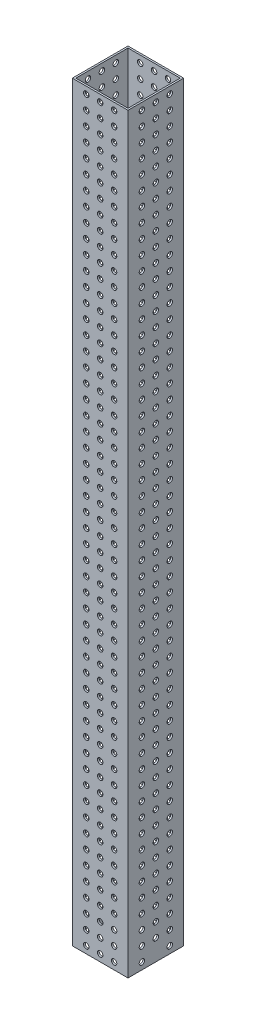
from build123d import *

# Parameters (mm, degrees)
SKETCH1_W           = 50.8
SKETCH1_H           = 50.8
SKETCH1_W_2         = 47.625
SKETCH1_H_2         = 47.625
BOSS_EXTRUDE1_DEPTH = 685.8
SKETCH2_R           = 2.4892
CUT_EXTRUDE1_DEPTH  = 689.147832955
SKETCH4_R           = 2.4892
CUT_EXTRUDE2_DEPTH  = 689.147832955


with BuildPart() as part:
    # Sketch1 → Boss-Extrude1 (new body)
    with BuildSketch(Plane(origin=(0, 0, 0), x_dir=(1, 0, 0), z_dir=(0, 1, 0))):
        Rectangle(SKETCH1_W, SKETCH1_H)
        Rectangle(SKETCH1_W_2, SKETCH1_H_2, mode=Mode.SUBTRACT)
    extrude(amount=BOSS_EXTRUDE1_DEPTH)

    # Sketch2 → Cut-Extrude1 (cut, through all)
    with BuildSketch(Plane.XY.offset(25.4)):
        with Locations((-12.7, 679.45)):
            Circle(SKETCH2_R)
        with Locations((-12.7, 666.75)):
            Circle(SKETCH2_R)
        with Locations((-12.7, 654.05)):
            Circle(SKETCH2_R)
        with Locations((-12.7, 641.35)):
            Circle(SKETCH2_R)
        with Locations((-12.7, 628.65)):
            Circle(SKETCH2_R)
        with Locations((-12.7, 615.95)):
            Circle(SKETCH2_R)
        with Locations((-12.7, 603.25)):
            Circle(SKETCH2_R)
        with Locations((-12.7, 590.55)):
            Circle(SKETCH2_R)
        with Locations((-12.7, 577.85)):
            Circle(SKETCH2_R)
        with Locations((-12.7, 565.15)):
            Circle(SKETCH2_R)
        with Locations((-12.7, 552.45)):
            Circle(SKETCH2_R)
        with Locations((-12.7, 539.75)):
            Circle(SKETCH2_R)
        with Locations((-12.7, 527.05)):
            Circle(SKETCH2_R)
        with Locations((-12.7, 514.35)):
            Circle(SKETCH2_R)
        with Locations((-12.7, 501.65)):
            Circle(SKETCH2_R)
        with Locations((-12.7, 488.95)):
            Circle(SKETCH2_R)
        with Locations((-12.7, 476.25)):
            Circle(SKETCH2_R)
        with Locations((-12.7, 463.55)):
            Circle(SKETCH2_R)
        with Locations((-12.7, 450.85)):
            Circle(SKETCH2_R)
        with Locations((-12.7, 438.15)):
            Circle(SKETCH2_R)
        with Locations((-12.7, 425.45)):
            Circle(SKETCH2_R)
        with Locations((-12.7, 412.75)):
            Circle(SKETCH2_R)
        with Locations((-12.7, 400.05)):
            Circle(SKETCH2_R)
        with Locations((-12.7, 387.35)):
            Circle(SKETCH2_R)
        with Locations((-12.7, 374.65)):
            Circle(SKETCH2_R)
        with Locations((-12.7, 361.95)):
            Circle(SKETCH2_R)
        with Locations((-12.7, 349.25)):
            Circle(SKETCH2_R)
        with Locations((-12.7, 336.55)):
            Circle(SKETCH2_R)
        with Locations((-12.7, 323.85)):
            Circle(SKETCH2_R)
        with Locations((-12.7, 311.15)):
            Circle(SKETCH2_R)
        with Locations((-12.7, 298.45)):
            Circle(SKETCH2_R)
        with Locations((-12.7, 285.75)):
            Circle(SKETCH2_R)
        with Locations((-12.7, 273.05)):
            Circle(SKETCH2_R)
        with Locations((-12.7, 260.35)):
            Circle(SKETCH2_R)
        with Locations((-12.7, 247.65)):
            Circle(SKETCH2_R)
        with Locations((-12.7, 234.95)):
            Circle(SKETCH2_R)
        with Locations((-12.7, 222.25)):
            Circle(SKETCH2_R)
        with Locations((-12.7, 209.55)):
            Circle(SKETCH2_R)
        with Locations((-12.7, 196.85)):
            Circle(SKETCH2_R)
        with Locations((-12.7, 184.15)):
            Circle(SKETCH2_R)
        with Locations((-12.7, 171.45)):
            Circle(SKETCH2_R)
        with Locations((-12.7, 158.75)):
            Circle(SKETCH2_R)
        with Locations((-12.7, 146.05)):
            Circle(SKETCH2_R)
        with Locations((-12.7, 133.35)):
            Circle(SKETCH2_R)
        with Locations((-12.7, 120.65)):
            Circle(SKETCH2_R)
        with Locations((-12.7, 107.95)):
            Circle(SKETCH2_R)
        with Locations((-12.7, 95.25)):
            Circle(SKETCH2_R)
        with Locations((-12.7, 82.55)):
            Circle(SKETCH2_R)
        with Locations((-12.7, 69.85)):
            Circle(SKETCH2_R)
        with Locations((-12.7, 57.15)):
            Circle(SKETCH2_R)
        with Locations((-12.7, 44.45)):
            Circle(SKETCH2_R)
        with Locations((-12.7, 31.75)):
            Circle(SKETCH2_R)
        with Locations((-12.7, 19.05)):
            Circle(SKETCH2_R)
        with Locations((-12.7, 6.35)):
            Circle(SKETCH2_R)
        with Locations((12.7, 6.35)):
            Circle(SKETCH2_R)
        with Locations((12.7, 19.05)):
            Circle(SKETCH2_R)
        with Locations((12.7, 31.75)):
            Circle(SKETCH2_R)
        with Locations((12.7, 44.45)):
            Circle(SKETCH2_R)
        with Locations((12.7, 57.15)):
            Circle(SKETCH2_R)
        with Locations((12.7, 69.85)):
            Circle(SKETCH2_R)
        with Locations((12.7, 82.55)):
            Circle(SKETCH2_R)
        with Locations((12.7, 95.25)):
            Circle(SKETCH2_R)
        with Locations((12.7, 107.95)):
            Circle(SKETCH2_R)
        with Locations((12.7, 120.65)):
            Circle(SKETCH2_R)
        with Locations((12.7, 133.35)):
            Circle(SKETCH2_R)
        with Locations((12.7, 146.05)):
            Circle(SKETCH2_R)
        with Locations((12.7, 158.75)):
            Circle(SKETCH2_R)
        with Locations((12.7, 171.45)):
            Circle(SKETCH2_R)
        with Locations((12.7, 184.15)):
            Circle(SKETCH2_R)
        with Locations((12.7, 196.85)):
            Circle(SKETCH2_R)
        with Locations((12.7, 209.55)):
            Circle(SKETCH2_R)
        with Locations((12.7, 222.25)):
            Circle(SKETCH2_R)
        with Locations((12.7, 234.95)):
            Circle(SKETCH2_R)
        with Locations((12.7, 247.65)):
            Circle(SKETCH2_R)
        with Locations((12.7, 260.35)):
            Circle(SKETCH2_R)
        with Locations((12.7, 273.05)):
            Circle(SKETCH2_R)
        with Locations((12.7, 285.75)):
            Circle(SKETCH2_R)
        with Locations((12.7, 298.45)):
            Circle(SKETCH2_R)
        with Locations((12.7, 311.15)):
            Circle(SKETCH2_R)
        with Locations((12.7, 323.85)):
            Circle(SKETCH2_R)
        with Locations((12.7, 336.55)):
            Circle(SKETCH2_R)
        with Locations((12.7, 374.65)):
            Circle(SKETCH2_R)
        with Locations((12.7, 361.95)):
            Circle(SKETCH2_R)
        with Locations((12.7, 349.25)):
            Circle(SKETCH2_R)
        with Locations((12.7, 387.35)):
            Circle(SKETCH2_R)
        with Locations((12.7, 400.05)):
            Circle(SKETCH2_R)
        with Locations((12.7, 412.75)):
            Circle(SKETCH2_R)
        with Locations((12.7, 425.45)):
            Circle(SKETCH2_R)
        with Locations((12.7, 438.15)):
            Circle(SKETCH2_R)
        with Locations((12.7, 450.85)):
            Circle(SKETCH2_R)
        with Locations((12.7, 463.55)):
            Circle(SKETCH2_R)
        with Locations((12.7, 476.25)):
            Circle(SKETCH2_R)
        with Locations((12.7, 488.95)):
            Circle(SKETCH2_R)
        with Locations((12.7, 501.65)):
            Circle(SKETCH2_R)
        with Locations((12.7, 514.35)):
            Circle(SKETCH2_R)
        with Locations((12.7, 527.05)):
            Circle(SKETCH2_R)
        with Locations((12.7, 539.75)):
            Circle(SKETCH2_R)
        with Locations((12.7, 552.45)):
            Circle(SKETCH2_R)
        with Locations((12.7, 565.15)):
            Circle(SKETCH2_R)
        with Locations((12.7, 577.85)):
            Circle(SKETCH2_R)
        with Locations((12.7, 590.55)):
            Circle(SKETCH2_R)
        with Locations((12.7, 603.25)):
            Circle(SKETCH2_R)
        with Locations((12.7, 615.95)):
            Circle(SKETCH2_R)
        with Locations((12.7, 628.65)):
            Circle(SKETCH2_R)
        with Locations((12.7, 641.35)):
            Circle(SKETCH2_R)
        with Locations((12.7, 654.05)):
            Circle(SKETCH2_R)
        with Locations((12.7, 666.75)):
            Circle(SKETCH2_R)
        with Locations((12.7, 679.45)):
            Circle(SKETCH2_R)
        with Locations((0, 6.35)):
            Circle(SKETCH2_R)
        with Locations((0, 19.05)):
            Circle(SKETCH2_R)
        with Locations((0, 31.75)):
            Circle(SKETCH2_R)
        with Locations((0, 44.45)):
            Circle(SKETCH2_R)
        with Locations((0, 57.15)):
            Circle(SKETCH2_R)
        with Locations((0, 69.85)):
            Circle(SKETCH2_R)
        with Locations((0, 82.55)):
            Circle(SKETCH2_R)
        with Locations((0, 95.25)):
            Circle(SKETCH2_R)
        with Locations((0, 107.95)):
            Circle(SKETCH2_R)
        with Locations((0, 120.65)):
            Circle(SKETCH2_R)
        with Locations((0, 133.35)):
            Circle(SKETCH2_R)
        with Locations((0, 146.05)):
            Circle(SKETCH2_R)
        with Locations((0, 158.75)):
            Circle(SKETCH2_R)
        with Locations((0, 171.45)):
            Circle(SKETCH2_R)
        with Locations((0, 184.15)):
            Circle(SKETCH2_R)
        with Locations((0, 196.85)):
            Circle(SKETCH2_R)
        with Locations((0, 209.55)):
            Circle(SKETCH2_R)
        with Locations((0, 222.25)):
            Circle(SKETCH2_R)
        with Locations((0, 234.95)):
            Circle(SKETCH2_R)
        with Locations((0, 247.65)):
            Circle(SKETCH2_R)
        with Locations((0, 260.35)):
            Circle(SKETCH2_R)
        with Locations((0, 273.05)):
            Circle(SKETCH2_R)
        with Locations((0, 285.75)):
            Circle(SKETCH2_R)
        with Locations((0, 298.45)):
            Circle(SKETCH2_R)
        with Locations((0, 311.15)):
            Circle(SKETCH2_R)
        with Locations((0, 323.85)):
            Circle(SKETCH2_R)
        with Locations((0, 336.55)):
            Circle(SKETCH2_R)
        with Locations((0, 349.25)):
            Circle(SKETCH2_R)
        with Locations((0, 361.95)):
            Circle(SKETCH2_R)
        with Locations((0, 374.65)):
            Circle(SKETCH2_R)
        with Locations((0, 387.35)):
            Circle(SKETCH2_R)
        with Locations((0, 400.05)):
            Circle(SKETCH2_R)
        with Locations((0, 412.75)):
            Circle(SKETCH2_R)
        with Locations((0, 425.45)):
            Circle(SKETCH2_R)
        with Locations((0, 438.15)):
            Circle(SKETCH2_R)
        with Locations((0, 450.85)):
            Circle(SKETCH2_R)
        with Locations((0, 463.55)):
            Circle(SKETCH2_R)
        with Locations((0, 476.25)):
            Circle(SKETCH2_R)
        with Locations((0, 488.95)):
            Circle(SKETCH2_R)
        with Locations((0, 501.65)):
            Circle(SKETCH2_R)
        with Locations((0, 514.35)):
            Circle(SKETCH2_R)
        with Locations((0, 527.05)):
            Circle(SKETCH2_R)
        with Locations((0, 539.75)):
            Circle(SKETCH2_R)
        with Locations((0, 552.45)):
            Circle(SKETCH2_R)
        with Locations((0, 565.15)):
            Circle(SKETCH2_R)
        with Locations((0, 577.85)):
            Circle(SKETCH2_R)
        with Locations((0, 590.55)):
            Circle(SKETCH2_R)
        with Locations((0, 603.25)):
            Circle(SKETCH2_R)
        with Locations((0, 615.95)):
            Circle(SKETCH2_R)
        with Locations((0, 628.65)):
            Circle(SKETCH2_R)
        with Locations((0, 641.35)):
            Circle(SKETCH2_R)
        with Locations((0, 654.05)):
            Circle(SKETCH2_R)
        with Locations((0, 666.75)):
            Circle(SKETCH2_R)
        with Locations((0, 679.45)):
            Circle(SKETCH2_R)
    extrude(amount=-CUT_EXTRUDE1_DEPTH, mode=Mode.SUBTRACT)

    # Sketch4 → Cut-Extrude2 (cut, through all)
    with BuildSketch(Plane(origin=(25.4, 0, 0), x_dir=(0, 0, -1), z_dir=(1, 0, 0))):
        with Locations((-12.7, 679.45)):
            Circle(SKETCH4_R)
        with Locations((-12.7, 666.75)):
            Circle(SKETCH4_R)
        with Locations((-12.7, 654.05)):
            Circle(SKETCH4_R)
        with Locations((-12.7, 641.35)):
            Circle(SKETCH4_R)
        with Locations((-12.7, 628.65)):
            Circle(SKETCH4_R)
        with Locations((-12.7, 615.95)):
            Circle(SKETCH4_R)
        with Locations((-12.7, 603.25)):
            Circle(SKETCH4_R)
        with Locations((-12.7, 590.55)):
            Circle(SKETCH4_R)
        with Locations((-12.7, 577.85)):
            Circle(SKETCH4_R)
        with Locations((-12.7, 565.15)):
            Circle(SKETCH4_R)
        with Locations((-12.7, 552.45)):
            Circle(SKETCH4_R)
        with Locations((-12.7, 539.75)):
            Circle(SKETCH4_R)
        with Locations((-12.7, 527.05)):
            Circle(SKETCH4_R)
        with Locations((-12.7, 514.35)):
            Circle(SKETCH4_R)
        with Locations((-12.7, 501.65)):
            Circle(SKETCH4_R)
        with Locations((-12.7, 488.95)):
            Circle(SKETCH4_R)
        with Locations((-12.7, 476.25)):
            Circle(SKETCH4_R)
        with Locations((-12.7, 463.55)):
            Circle(SKETCH4_R)
        with Locations((-12.7, 450.85)):
            Circle(SKETCH4_R)
        with Locations((-12.7, 438.15)):
            Circle(SKETCH4_R)
        with Locations((-12.7, 425.45)):
            Circle(SKETCH4_R)
        with Locations((-12.7, 412.75)):
            Circle(SKETCH4_R)
        with Locations((-12.7, 400.05)):
            Circle(SKETCH4_R)
        with Locations((-12.7, 387.35)):
            Circle(SKETCH4_R)
        with Locations((-12.7, 374.65)):
            Circle(SKETCH4_R)
        with Locations((-12.7, 361.95)):
            Circle(SKETCH4_R)
        with Locations((-12.7, 349.25)):
            Circle(SKETCH4_R)
        with Locations((-12.7, 336.55)):
            Circle(SKETCH4_R)
        with Locations((-12.7, 323.85)):
            Circle(SKETCH4_R)
        with Locations((-12.7, 311.15)):
            Circle(SKETCH4_R)
        with Locations((-12.7, 298.45)):
            Circle(SKETCH4_R)
        with Locations((-12.7, 285.75)):
            Circle(SKETCH4_R)
        with Locations((-12.7, 273.05)):
            Circle(SKETCH4_R)
        with Locations((-12.7, 260.35)):
            Circle(SKETCH4_R)
        with Locations((-12.7, 247.65)):
            Circle(SKETCH4_R)
        with Locations((-12.7, 234.95)):
            Circle(SKETCH4_R)
        with Locations((-12.7, 222.25)):
            Circle(SKETCH4_R)
        with Locations((-12.7, 209.55)):
            Circle(SKETCH4_R)
        with Locations((-12.7, 196.85)):
            Circle(SKETCH4_R)
        with Locations((-12.7, 184.15)):
            Circle(SKETCH4_R)
        with Locations((-12.7, 171.45)):
            Circle(SKETCH4_R)
        with Locations((-12.7, 158.75)):
            Circle(SKETCH4_R)
        with Locations((-12.7, 146.05)):
            Circle(SKETCH4_R)
        with Locations((-12.7, 133.35)):
            Circle(SKETCH4_R)
        with Locations((-12.7, 120.65)):
            Circle(SKETCH4_R)
        with Locations((-12.7, 107.95)):
            Circle(SKETCH4_R)
        with Locations((-12.7, 95.25)):
            Circle(SKETCH4_R)
        with Locations((-12.7, 82.55)):
            Circle(SKETCH4_R)
        with Locations((-12.7, 69.85)):
            Circle(SKETCH4_R)
        with Locations((-12.7, 57.15)):
            Circle(SKETCH4_R)
        with Locations((-12.7, 44.45)):
            Circle(SKETCH4_R)
        with Locations((-12.7, 31.75)):
            Circle(SKETCH4_R)
        with Locations((-12.7, 19.05)):
            Circle(SKETCH4_R)
        with Locations((-12.7, 6.35)):
            Circle(SKETCH4_R)
        with Locations(Location((12.7, 273.05, 0), (0, 0, 180))):
            Circle(SKETCH4_R)
        with Locations(Location((12.7, 285.75, 0), (0, 0, 180))):
            Circle(SKETCH4_R)
        with Locations(Location((12.7, 298.45, 0), (0, 0, 180))):
            Circle(SKETCH4_R)
        with Locations(Location((12.7, 311.15, 0), (0, 0, 180))):
            Circle(SKETCH4_R)
        with Locations(Location((12.7, 323.85, 0), (0, 0, 180))):
            Circle(SKETCH4_R)
        with Locations(Location((12.7, 336.55, 0), (0, 0, 180))):
            Circle(SKETCH4_R)
        with Locations(Location((12.7, 349.25, 0), (0, 0, 180))):
            Circle(SKETCH4_R)
        with Locations(Location((12.7, 361.95, 0), (0, 0, 180))):
            Circle(SKETCH4_R)
        with Locations(Location((12.7, 374.65, 0), (0, 0, 180))):
            Circle(SKETCH4_R)
        with Locations(Location((12.7, 387.35, 0), (0, 0, 180))):
            Circle(SKETCH4_R)
        with Locations(Location((12.7, 400.05, 0), (0, 0, 180))):
            Circle(SKETCH4_R)
        with Locations(Location((12.7, 412.75, 0), (0, 0, 180))):
            Circle(SKETCH4_R)
        with Locations(Location((12.7, 425.45, 0), (0, 0, 180))):
            Circle(SKETCH4_R)
        with Locations(Location((12.7, 438.15, 0), (0, 0, 180))):
            Circle(SKETCH4_R)
        with Locations(Location((12.7, 450.85, 0), (0, 0, 180))):
            Circle(SKETCH4_R)
        with Locations(Location((12.7, 463.55, 0), (0, 0, 180))):
            Circle(SKETCH4_R)
        with Locations(Location((12.7, 476.25, 0), (0, 0, 180))):
            Circle(SKETCH4_R)
        with Locations(Location((12.7, 488.95, 0), (0, 0, 180))):
            Circle(SKETCH4_R)
        with Locations(Location((12.7, 501.65, 0), (0, 0, 180))):
            Circle(SKETCH4_R)
        with Locations(Location((12.7, 514.35, 0), (0, 0, 180))):
            Circle(SKETCH4_R)
        with Locations(Location((12.7, 527.05, 0), (0, 0, 180))):
            Circle(SKETCH4_R)
        with Locations(Location((12.7, 539.75, 0), (0, 0, 180))):
            Circle(SKETCH4_R)
        with Locations(Location((12.7, 552.45, 0), (0, 0, 180))):
            Circle(SKETCH4_R)
        with Locations(Location((12.7, 565.15, 0), (0, 0, 180))):
            Circle(SKETCH4_R)
        with Locations(Location((12.7, 577.85, 0), (0, 0, 180))):
            Circle(SKETCH4_R)
        with Locations(Location((12.7, 590.55, 0), (0, 0, 180))):
            Circle(SKETCH4_R)
        with Locations(Location((12.7, 603.25, 0), (0, 0, 180))):
            Circle(SKETCH4_R)
        with Locations(Location((12.7, 615.95, 0), (0, 0, 180))):
            Circle(SKETCH4_R)
        with Locations(Location((12.7, 628.65, 0), (0, 0, 180))):
            Circle(SKETCH4_R)
        with Locations(Location((12.7, 641.35, 0), (0, 0, 180))):
            Circle(SKETCH4_R)
        with Locations(Location((12.7, 654.05, 0), (0, 0, 180))):
            Circle(SKETCH4_R)
        with Locations(Location((12.7, 666.75, 0), (0, 0, 180))):
            Circle(SKETCH4_R)
        with Locations(Location((12.7, 19.05, 0), (0, 0, 180))):
            Circle(SKETCH4_R)
        with Locations(Location((12.7, 31.75, 0), (0, 0, 180))):
            Circle(SKETCH4_R)
        with Locations(Location((12.7, 44.45, 0), (0, 0, 180))):
            Circle(SKETCH4_R)
        with Locations(Location((12.7, 57.15, 0), (0, 0, 180))):
            Circle(SKETCH4_R)
        with Locations(Location((12.7, 69.85, 0), (0, 0, 180))):
            Circle(SKETCH4_R)
        with Locations(Location((12.7, 82.55, 0), (0, 0, 180))):
            Circle(SKETCH4_R)
        with Locations(Location((12.7, 95.25, 0), (0, 0, 180))):
            Circle(SKETCH4_R)
        with Locations(Location((12.7, 107.95, 0), (0, 0, 180))):
            Circle(SKETCH4_R)
        with Locations(Location((12.7, 120.65, 0), (0, 0, 180))):
            Circle(SKETCH4_R)
        with Locations(Location((12.7, 133.35, 0), (0, 0, 180))):
            Circle(SKETCH4_R)
        with Locations(Location((12.7, 146.05, 0), (0, 0, 180))):
            Circle(SKETCH4_R)
        with Locations(Location((12.7, 158.75, 0), (0, 0, 180))):
            Circle(SKETCH4_R)
        with Locations(Location((12.7, 171.45, 0), (0, 0, 180))):
            Circle(SKETCH4_R)
        with Locations(Location((12.7, 184.15, 0), (0, 0, 180))):
            Circle(SKETCH4_R)
        with Locations(Location((12.7, 196.85, 0), (0, 0, 180))):
            Circle(SKETCH4_R)
        with Locations(Location((12.7, 209.55, 0), (0, 0, 180))):
            Circle(SKETCH4_R)
        with Locations(Location((12.7, 222.25, 0), (0, 0, 180))):
            Circle(SKETCH4_R)
        with Locations(Location((12.7, 234.95, 0), (0, 0, 180))):
            Circle(SKETCH4_R)
        with Locations(Location((12.7, 247.65, 0), (0, 0, 180))):
            Circle(SKETCH4_R)
        with Locations(Location((12.7, 260.35, 0), (0, 0, 180))):
            Circle(SKETCH4_R)
        with Locations(Location((12.7, 6.35, 0), (0, 0, 180))):
            Circle(SKETCH4_R)
        with Locations(Location((12.7, 679.45, 0), (0, 0, 180))):
            Circle(SKETCH4_R)
        with Locations(Location((0, 82.55, 0), (0, 0, 180))):
            Circle(SKETCH4_R)
        with Locations(Location((0, 19.05, 0), (0, 0, 180))):
            Circle(SKETCH4_R)
        with Locations(Location((0, 31.75, 0), (0, 0, 180))):
            Circle(SKETCH4_R)
        with Locations(Location((0, 44.45, 0), (0, 0, 180))):
            Circle(SKETCH4_R)
        with Locations(Location((0, 57.15, 0), (0, 0, 180))):
            Circle(SKETCH4_R)
        with Locations(Location((0, 69.85, 0), (0, 0, 180))):
            Circle(SKETCH4_R)
        with Locations(Location((0, 95.25, 0), (0, 0, 180))):
            Circle(SKETCH4_R)
        with Locations(Location((0, 107.95, 0), (0, 0, 180))):
            Circle(SKETCH4_R)
        with Locations(Location((0, 120.65, 0), (0, 0, 180))):
            Circle(SKETCH4_R)
        with Locations(Location((0, 133.35, 0), (0, 0, 180))):
            Circle(SKETCH4_R)
        with Locations(Location((0, 146.05, 0), (0, 0, 180))):
            Circle(SKETCH4_R)
        with Locations(Location((0, 158.75, 0), (0, 0, 180))):
            Circle(SKETCH4_R)
        with Locations(Location((0, 171.45, 0), (0, 0, 180))):
            Circle(SKETCH4_R)
        with Locations(Location((0, 184.15, 0), (0, 0, 180))):
            Circle(SKETCH4_R)
        with Locations(Location((0, 196.85, 0), (0, 0, 180))):
            Circle(SKETCH4_R)
        with Locations(Location((0, 209.55, 0), (0, 0, 180))):
            Circle(SKETCH4_R)
        with Locations(Location((0, 222.25, 0), (0, 0, 180))):
            Circle(SKETCH4_R)
        with Locations(Location((0, 234.95, 0), (0, 0, 180))):
            Circle(SKETCH4_R)
        with Locations(Location((0, 247.65, 0), (0, 0, 180))):
            Circle(SKETCH4_R)
        with Locations(Location((0, 260.35, 0), (0, 0, 180))):
            Circle(SKETCH4_R)
        with Locations(Location((0, 273.05, 0), (0, 0, 180))):
            Circle(SKETCH4_R)
        with Locations(Location((0, 285.75, 0), (0, 0, 180))):
            Circle(SKETCH4_R)
        with Locations(Location((0, 298.45, 0), (0, 0, 180))):
            Circle(SKETCH4_R)
        with Locations(Location((0, 311.15, 0), (0, 0, 180))):
            Circle(SKETCH4_R)
        with Locations(Location((0, 323.85, 0), (0, 0, 180))):
            Circle(SKETCH4_R)
        with Locations(Location((0, 336.55, 0), (0, 0, 180))):
            Circle(SKETCH4_R)
        with Locations(Location((0, 361.95, 0), (0, 0, 180))):
            Circle(SKETCH4_R)
        with Locations(Location((0, 374.65, 0), (0, 0, 180))):
            Circle(SKETCH4_R)
        with Locations(Location((0, 387.35, 0), (0, 0, 180))):
            Circle(SKETCH4_R)
        with Locations(Location((0, 400.05, 0), (0, 0, 180))):
            Circle(SKETCH4_R)
        with Locations(Location((0, 412.75, 0), (0, 0, 180))):
            Circle(SKETCH4_R)
        with Locations(Location((0, 425.45, 0), (0, 0, 180))):
            Circle(SKETCH4_R)
        with Locations(Location((0, 438.15, 0), (0, 0, 180))):
            Circle(SKETCH4_R)
        with Locations(Location((0, 450.85, 0), (0, 0, 180))):
            Circle(SKETCH4_R)
        with Locations(Location((0, 463.55, 0), (0, 0, 180))):
            Circle(SKETCH4_R)
        with Locations(Location((0, 476.25, 0), (0, 0, 180))):
            Circle(SKETCH4_R)
        with Locations(Location((0, 488.95, 0), (0, 0, 180))):
            Circle(SKETCH4_R)
        with Locations(Location((0, 501.65, 0), (0, 0, 180))):
            Circle(SKETCH4_R)
        with Locations(Location((0, 514.35, 0), (0, 0, 180))):
            Circle(SKETCH4_R)
        with Locations(Location((0, 527.05, 0), (0, 0, 180))):
            Circle(SKETCH4_R)
        with Locations(Location((0, 539.75, 0), (0, 0, 180))):
            Circle(SKETCH4_R)
        with Locations(Location((0, 552.45, 0), (0, 0, 180))):
            Circle(SKETCH4_R)
        with Locations(Location((0, 565.15, 0), (0, 0, 180))):
            Circle(SKETCH4_R)
        with Locations(Location((0, 577.85, 0), (0, 0, 180))):
            Circle(SKETCH4_R)
        with Locations(Location((0, 590.55, 0), (0, 0, 180))):
            Circle(SKETCH4_R)
        with Locations(Location((0, 603.25, 0), (0, 0, 180))):
            Circle(SKETCH4_R)
        with Locations(Location((0, 615.95, 0), (0, 0, 180))):
            Circle(SKETCH4_R)
        with Locations(Location((0, 628.65, 0), (0, 0, 180))):
            Circle(SKETCH4_R)
        with Locations(Location((0, 641.35, 0), (0, 0, 180))):
            Circle(SKETCH4_R)
        with Locations(Location((0, 654.05, 0), (0, 0, 180))):
            Circle(SKETCH4_R)
        with Locations(Location((0, 666.75, 0), (0, 0, 180))):
            Circle(SKETCH4_R)
        with Locations(Location((0, 679.45, 0), (0, 0, 180))):
            Circle(SKETCH4_R)
        with Locations(Location((0, 349.25, 0), (0, 0, 180))):
            Circle(SKETCH4_R)
    extrude(amount=-CUT_EXTRUDE2_DEPTH, mode=Mode.SUBTRACT)


solid = part.part
